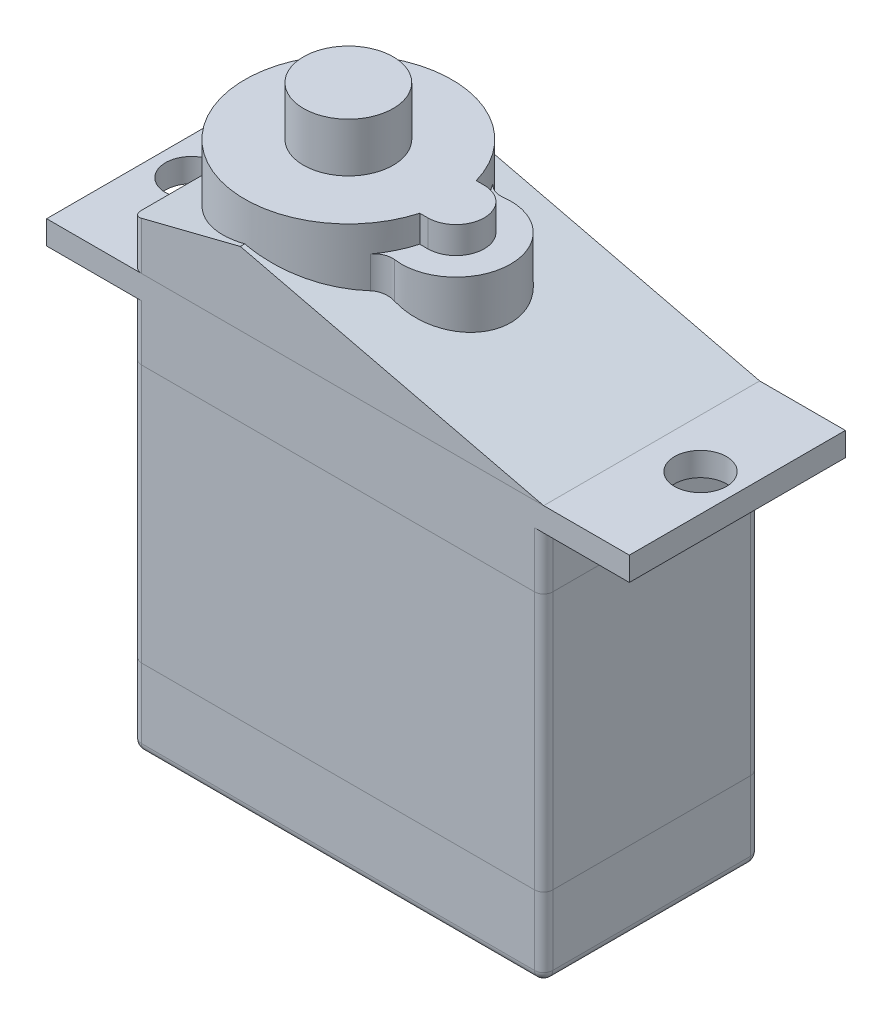
from build123d import *

# Parameters (mm, degrees)
SKETCH1_W              = 22.9489
SKETCH1_H              = 12.0523
BOSS_EXTRUDE1_DEPTH    = 4.4
SKETCH2_W              = 22.9489
SKETCH2_H              = 12.0523
BOSS_EXTRUDE4_DEPTH    = 14.4
SKETCH5_W              = 22.9489
SKETCH5_H              = 12.0523
BOSS_EXTRUDE6_DEPTH    = 4.4196
SKETCH7_W              = 12.0523
SKETCH7_H              = 1.3208
BOSS_EXTRUDE9_DEPTH    = 4.78155
SKETCH10_R             = 1.4478
CUT_EXTRUDE1_DEPTH     = 1.3208
BOSS_EXTRUDE10_DEPTH   = 4.7244
FILLET1_R              = 0.508
BOSS_EXTRUDE11_DEPTH   = 1.4986
SKETCH13_R             = 2.5019
BOSS_EXTRUDE12_DEPTH   = 2.7432
SKETCH14_W             = 6.8834
SKETCH14_H             = 4.4
BOSS_EXTRUDE14_DEPTH   = 0.4064
SKETCH15_R             = 0.5715
BOSS_EXTRUDE15_DEPTH   = 1.27
BOSS_EXTRUDE15_2_DEPTH = 1.27
BOSS_EXTRUDE15_3_DEPTH = 1.27
FILLET4_R              = 0.508
BOSS_EXTRUDE16_DEPTH   = 12.0523
FILLET5_R              = 0.508


with BuildPart() as part:
    # Sketch1 → Boss-Extrude1 (new body)
    with BuildSketch(Plane(origin=(0, 0, 0), x_dir=(1, 0, 0), z_dir=(0, 1, 0))):
        with Locations((11.47445, 6.02615)):
            Rectangle(SKETCH1_W, SKETCH1_H)
    extrude(amount=BOSS_EXTRUDE1_DEPTH)

    # Sketch14 → Boss-Extrude14 (add)
    with BuildSketch(Plane.ZY):
        with Locations((-6.02615, 2.2)):
            Rectangle(SKETCH14_W, SKETCH14_H)
    extrude(amount=BOSS_EXTRUDE14_DEPTH)

    # Fillet4
    fillet4_edges = [part.edges().sort_by_distance(p)[0] for p in [
        (-0.2032, 0, -9.46785),
        (-0.4064, 0, -6.02615),
        (-0.2032, 0, -2.58445),
        (0, 0, -1.292225),
        (11.47445, 0, 0),
        (22.9489, 0, -6.02615),
        (11.47445, 0, -12.0523),
        (0, 0, -10.760075),
        (0, 2.2, 0),
        (22.9489, 2.2, 0),
        (22.9489, 2.2, -12.0523),
        (0, 2.2, -12.0523),
    ]]
    fillet(fillet4_edges, radius=FILLET4_R)


with BuildPart() as body_2:
    # Sketch2 → Boss-Extrude4 (new body)
    with BuildSketch(Plane(origin=(0, 4.4, 0), x_dir=(1, 0, 0), z_dir=(0, 1, 0))):
        with Locations((11.47445, 6.02615)):
            Rectangle(SKETCH2_W, SKETCH2_H)
    extrude(amount=BOSS_EXTRUDE4_DEPTH)

    # Fillet1
    fillet1_edges = [body_2.edges().sort_by_distance(p)[0] for p in [
        (0, 11.6, -12.0523),
        (22.9489, 11.6, -12.0523),
        (22.9489, 11.6, 0),
        (0, 11.6, 0),
    ]]
    fillet(fillet1_edges, radius=FILLET1_R)


with BuildPart() as body_3:
    # Sketch5 → Boss-Extrude6 (new body)
    with BuildSketch(Plane(origin=(0, 18.8, 0), x_dir=(1, 0, 0), z_dir=(0, 1, 0))):
        with Locations((11.47445, 6.02615)):
            Rectangle(SKETCH5_W, SKETCH5_H)
    extrude(amount=BOSS_EXTRUDE6_DEPTH)

    # Sketch7 → Boss-Extrude9 (add)
    with BuildSketch(Plane.ZY):
        with Locations((-6.02615, 22.5592)):
            Rectangle(SKETCH7_W, SKETCH7_H)
    boss_extrude9 = extrude(amount=BOSS_EXTRUDE9_DEPTH)

    # Sketch10 → Cut-Extrude1 (cut)
    with BuildSketch(Plane(origin=(0, 23.2196, 0), x_dir=(1, 0, 0), z_dir=(0, 1, 0))):
        with Locations(Location((-2.72555, 6.02615, 0), (0, 0, 270))):
            Circle(SKETCH10_R)
    cut_extrude1 = extrude(amount=-CUT_EXTRUDE1_DEPTH, mode=Mode.SUBTRACT)

    # Mirror1: Boss-Extrude9, Cut-Extrude1 across plane
    add(boss_extrude9.mirror(Plane.ZY.offset(-11.47445)))
    add(cut_extrude1.mirror(Plane.ZY.offset(-11.47445)), mode=Mode.SUBTRACT)



with BuildPart() as body_4:
    # Sketch11 → Boss-Extrude10 (new body)
    with BuildSketch(Plane(origin=(0, 23.2196, 0), x_dir=(1, 0, 0), z_dir=(0, 1, 0))):
        with BuildLine():
            ThreePointArc((10.679388997, 9.452289093), (0.24765, 6.02615), (10.679388997, 2.600010907))
            ThreePointArc((10.679388997, 2.600010907), (11.100056709, 2.932632777), (11.631468182, 3.004747119))
            ThreePointArc((11.631468182, 3.004747119), (15.08125, 6.02615), (11.631468182, 9.047552881))
            ThreePointArc((11.631468182, 9.047552881), (11.100056709, 9.119667223), (10.679388997, 9.452289093))
        make_face()
    extrude(amount=BOSS_EXTRUDE10_DEPTH)

    # Sketch12 → Boss-Extrude11 (add)
    with BuildSketch(Plane(origin=(0, 27.944, 0), x_dir=(1, 0, 0), z_dir=(0, 1, 0))):
        with BuildLine():
            Line((12.03325, 4.45135), (11.585922226, 4.45135))
            ThreePointArc((11.585922226, 4.45135), (0.24765, 6.02615), (11.585922226, 7.60095))
            Line((11.585922226, 7.60095), (12.03325, 7.60095))
            ThreePointArc((12.03325, 7.60095), (13.60805, 6.02615), (12.03325, 4.45135))
        make_face()
    extrude(amount=BOSS_EXTRUDE11_DEPTH)

    # Sketch13 → Boss-Extrude12 (add)
    with BuildSketch(Plane(origin=(0, 29.4426, 0), x_dir=(1, 0, 0), z_dir=(0, 1, 0))):
        with Locations(Location((6.02615, 6.02615, 0), (0, 0, 270))):
            Circle(SKETCH13_R)
    extrude(amount=BOSS_EXTRUDE12_DEPTH)


with BuildPart() as body_5:
    # Sketch15 → Boss-Extrude15 (new body)
    with BuildSketch(Plane.ZY.offset(0.4064)):
        with Locations((-6.02615, 1.778)):
            Circle(SKETCH15_R)
    extrude(amount=BOSS_EXTRUDE15_DEPTH)


with BuildPart() as body_6:
    # Sketch15 → Boss-Extrude15 2 (new body)
    with BuildSketch(Plane.ZY.offset(0.4064)):
        with Locations((-4.88315, 1.778)):
            Circle(SKETCH15_R)
    extrude(amount=BOSS_EXTRUDE15_2_DEPTH)


with BuildPart() as body_7:
    # Sketch15 → Boss-Extrude15 3 (new body)
    with BuildSketch(Plane.ZY.offset(0.4064)):
        with Locations((-7.16915, 1.778)):
            Circle(SKETCH15_R)
    extrude(amount=BOSS_EXTRUDE15_3_DEPTH)


with BuildPart() as body_3_1:
    add(body_3.part)

    add(body_4.part)  # Boss-Extrude16 merges body 4
    # 3DSketch1 → Boss-Extrude16 (add, through all)
    with BuildSketch(Plane(origin=(6.02615, 27.2836, -12.0523), x_dir=(0.972354173200553, -0.23351094590932797, 0), z_dir=(0, 0, -1))):
        Polygon((0, 0), (17.403895069, 0), (-4.910563617, 5.358819347), (-5.503681419, 2.889039747), align=None)
    extrude(amount=-BOSS_EXTRUDE16_DEPTH)

    # Fillet5
    fillet5_edges = [body_3_1.edges().sort_by_distance(p)[0] for p in [
        (0, 24.4896, 0),
        (0, 24.4896, -12.0523),
        (0, 20.3494, -12.0523),
        (22.9489, 20.3494, -12.0523),
        (22.9489, 20.3494, 0),
        (0, 20.3494, 0),
    ]]
    fillet(fillet5_edges, radius=FILLET5_R)


solid = Compound([part.part, body_2.part, body_5.part, body_6.part, body_7.part, body_3_1.part])
